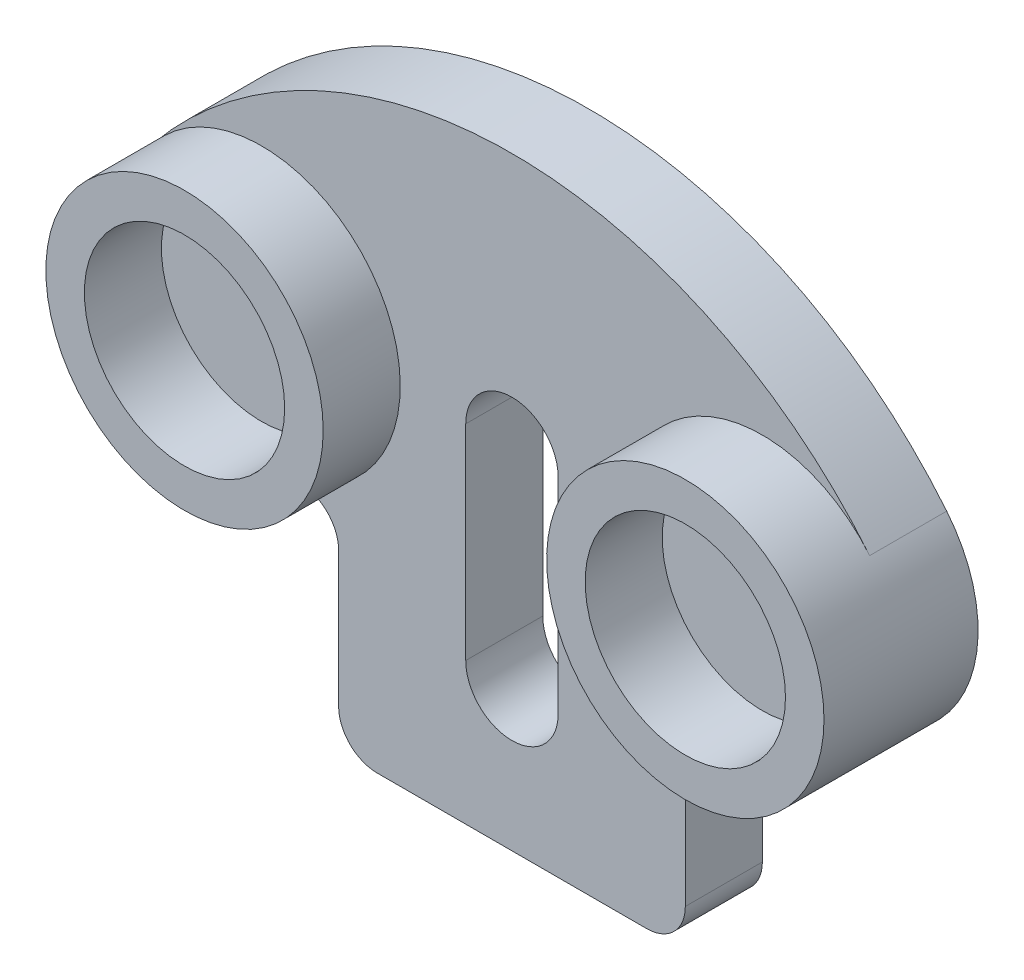
from build123d import *

# Parameters (mm, degrees)
BOSS_EXTRUDE1_DEPTH = 10
SKETCH1_3_R         = 18
SKETCH1_3_R_2       = 13
BOSS_EXTRUDE2_DEPTH = 20


with BuildPart() as part:
    # Sketch1 → Boss-Extrude1 (new body)
    with BuildSketch(Plane.XY):
        with BuildLine():
            Line((-17.5, -18.396428811), (17.5, -18.396428811))
            ThreePointArc((17.5, -18.396428811), (21.035533906, -16.931962717), (22.5, -13.396428811))
            Line((22.5, -13.396428811), (22.5, 4.153626868))
            ThreePointArc((22.5, 4.153626868), (24.372283789, 8.054574356), (28.586956522, 9.034049547))
            ThreePointArc((28.586956522, 9.034049547), (47.82671412, 17.164724105), (46.428571429, 38.005101698))
            ThreePointArc((46.428571429, 38.005101698), (0, 60), (-46.428571429, 38.005101698))
            ThreePointArc((-46.428571429, 38.005101698), (-47.82671412, 17.164724105), (-28.586956522, 9.034049547))
            ThreePointArc((-28.586956522, 9.034049547), (-24.372283789, 8.054574356), (-22.5, 4.153626868))
            Line((-22.5, 4.153626868), (-22.5, -13.396428811))
            ThreePointArc((-22.5, -13.396428811), (-21.035533906, -16.931962717), (-17.5, -18.396428811))
        make_face()
        with BuildLine():
            ThreePointArc((6, 0), (0, -6), (-6, 0))
            Line((-6, 0), (-6, 26.603571189))
            ThreePointArc((-6, 26.603571189), (0, 32.603571189), (6, 26.603571189))
            Line((6, 26.603571189), (6, 0))
        make_face(mode=Mode.SUBTRACT)
    extrude(amount=BOSS_EXTRUDE1_DEPTH)

    # Sketch1<3> → Boss-Extrude2 (add)
    # profile 1 of 2: a face of its own
    with BuildSketch(Plane.XY):
        with Locations((32.5, 26.603571189)):
            Circle(SKETCH1_3_R)
        with Locations((32.5, 26.603571189)):
            Circle(SKETCH1_3_R_2, mode=Mode.SUBTRACT)
    # profile 2 of 2: a face of its own
    with BuildSketch(Plane.XY):
        with Locations((-32.5, 26.603571189)):
            Circle(SKETCH1_3_R)
        with Locations((-32.5, 26.603571189)):
            Circle(SKETCH1_3_R_2, mode=Mode.SUBTRACT)
    extrude(amount=BOSS_EXTRUDE2_DEPTH)


solid = part.part
